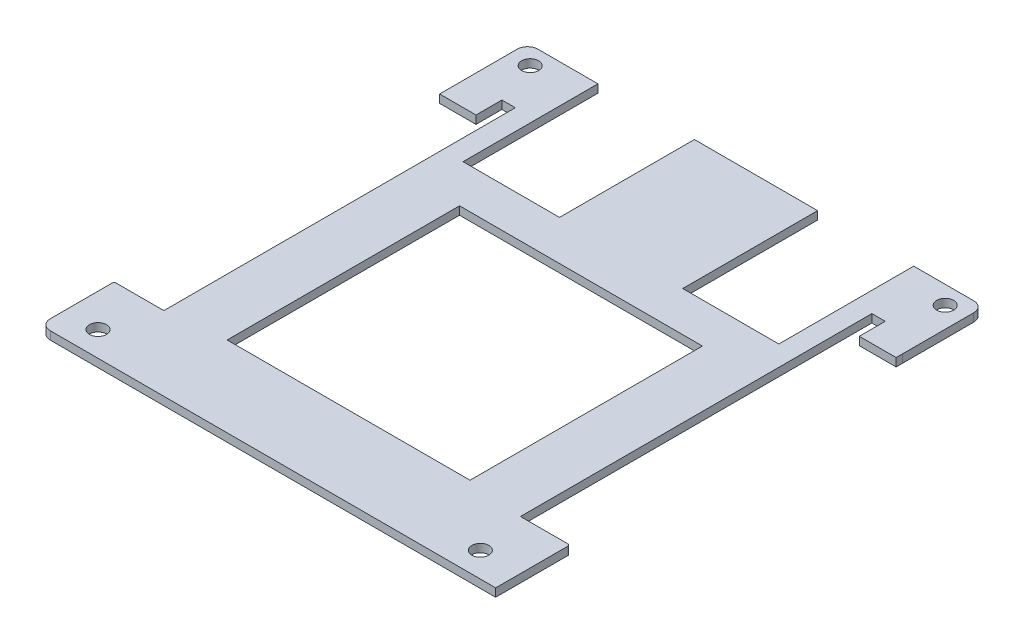
from build123d import *

# Parameters (mm, degrees)
SKETCH1_R                        = 1.6383
BOSS_EXTRUDE1_DEPTH              = 1.575
CUT_EXTRUDE1_DEPTH               = 2.54
CUTOUTS_FOR_THRUSTER_HEADS_DEPTH = 1.575
NOTCH_FOR_BPR_TOP_VIEW_W         = 2.575
NOTCH_FOR_BPR_TOP_VIEW_H         = 6.27
CUT_EXTRUDE11_DEPTH              = 10
NOTCH_FOR_BPL_TOP_VIEW_W         = 2.575
NOTCH_FOR_BPL_TOP_VIEW_H         = 6.27
CUT_EXTRUDE12_DEPTH              = 65.400936523
SKETCH22_W                       = 1.501374709
SKETCH22_H                       = 61.468
SKETCH22_W_2                     = 1.585
BOSS_EXTRUDE2_DEPTH              = 1.575
SKETCH23_W                       = 7.1002401
SKETCH23_H                       = 1.27
SKETCH23_W_2                     = 7.016
CUT_EXTRUDE13_DEPTH              = 65.400936523


with BuildPart() as part:
    # Sketch1 → Boss-Extrude1 (new body)
    with BuildSketch(Plane(origin=(0, 0, 0), x_dir=(1, 0, 0), z_dir=(0, 1, 0))):
        with BuildLine():
            Line((-44, 45), (-44, 29.162404323))
            ThreePointArc((-44, 29.162404323), (-43.886381258, 28.888104416), (-43.612081351, 28.774485674))
            Line((-43.612081351, 28.774485674), (-33.211918649, 28.774485674))
            ThreePointArc((-33.211918649, 28.774485674), (-32.937618742, 28.660866933), (-32.824, 28.386567026))
            Line((-32.824, 28.386567026), (-32.824, -32.305595677))
            ThreePointArc((-32.824, -32.305595677), (-32.937618742, -32.579895584), (-33.211918649, -32.693514326))
            Line((-33.211918649, -32.693514326), (-36.100000052, -32.693514326))
            Line((-36.100000052, -32.693514326), (-43.612081299, -32.693514326))
            ThreePointArc((-43.612081299, -32.693514326), (-43.886381206, -32.807133067), (-43.999999948, -33.081432974))
            Line((-43.999999948, -33.081432974), (-43.999999948, -38.977))
            Line((-43.999999948, -38.977), (-43.999999948, -45))
            ThreePointArc((-43.999999948, -45), (-43.41421351, -46.414213562), (-41.999999948, -47))
            Line((-41.999999948, -47), (42.705916546, -47))
            Line((42.705916546, -47), (43.849731117, -47))
            Line((43.849731117, -47), (43.849731117, -38.27))
            Line((43.849731117, -38.27), (43.849731117, -33.081432974))
            ThreePointArc((43.849731117, -33.081432974), (43.736112376, -32.807133067), (43.461812469, -32.693514326))
            Line((43.461812469, -32.693514326), (36.098785193, -32.693514326))
            Line((36.098785193, -32.693514326), (33.824, -32.693514326))
            Line((33.824, -32.693514326), (32.822785141, -32.693514326))
            Line((32.822785141, -32.693514326), (32.822785141, -30.469351623))
            Line((32.822785141, -30.469351623), (32.822785141, 27.774485674))
            ThreePointArc((32.822785141, 27.774485674), (33.11567836, 28.481592456), (33.822785141, 28.774485674))
            Line((33.822785141, 28.774485674), (43.611054239, 28.774485674))
            ThreePointArc((43.611054239, 28.774485674), (43.885287743, 28.88803803), (43.998972842, 29.162216531))
            Line((43.998972842, 29.162216531), (44, 31.284))
            Line((44, 31.284), (44, 45))
            ThreePointArc((44, 45), (43.414213562, 46.414213562), (42, 47))
            Line((42, 47), (-42, 47))
            ThreePointArc((-42, 47), (-43.414213562, 46.414213562), (-44, 45))
        make_face()
        with Locations(Location((40, 43.5, 0), (0, 0, 270))):
            Circle(SKETCH1_R, mode=Mode.SUBTRACT)
        with Locations(Location((-40, 43.5, 0), (0, 0, 270))):
            Circle(SKETCH1_R, mode=Mode.SUBTRACT)
        with Locations(Location((-37.599999948, -42.2, 0), (0, 0, 270))):
            Circle(SKETCH1_R, mode=Mode.SUBTRACT)
        with Locations(Location((36.100000052, -42.2, 0), (0, 0, 270))):
            Circle(SKETCH1_R, mode=Mode.SUBTRACT)
        Polygon((23.409, -31.5), (-23.409, -31.5), (-23.409, 13.29544), (-12.909, 13.29544), (-12.909, 25.99544), (12.909, 25.99544), (12.909, 13.29544), (23.409, 13.29544), align=None, mode=Mode.SUBTRACT)
    extrude(amount=BOSS_EXTRUDE1_DEPTH)

    # Sketch2 → Cut-Extrude1 (cut)
    with BuildSketch(Plane(origin=(0, 1.575, 0), x_dir=(1, 0, 0), z_dir=(0, 1, 0))):
        Polygon((-12.909, 19.06), (-30.435, 19.06), (-30.435, 47), (30.435, 47), (30.435, 19.06), (12.909, 19.06), (12.909, 25.99544), (-12.909, 25.99544), align=None)
    extrude(amount=-CUT_EXTRUDE1_DEPTH, mode=Mode.SUBTRACT)

    # Sketch16 → Cutouts for Thruster Heads (add)
    with BuildSketch(Plane(origin=(0, 1.575, 0), x_dir=(1, 0, 0), z_dir=(0, 1, 0))):
        Polygon((12.909, 19.06), (12.909, 13.29544), (-12.909, 13.29544), (-12.909, 19.06), (-30.435, 19.06), (-30.435, 21), (-11.838888217, 21), (-11.838888217, 47), (11.909, 47), (11.909, 21), (30.435, 21), (30.435, 19.06), align=None)
    extrude(amount=-CUTOUTS_FOR_THRUSTER_HEADS_DEPTH)

    # Notch for BPR (TOP VIEW) → Cut-Extrude11 (cut)
    with BuildSketch(Plane(origin=(0, 1.575, 0), x_dir=(1, 0, 0), z_dir=(0, 1, 0))):
        with Locations((-35.6965, 31.909485674)):
            Rectangle(NOTCH_FOR_BPR_TOP_VIEW_W, NOTCH_FOR_BPR_TOP_VIEW_H)
    extrude(amount=-CUT_EXTRUDE11_DEPTH, mode=Mode.SUBTRACT)

    # Notch for BPL (TOP VIEW) → Cut-Extrude12 (cut, through all)
    with BuildSketch(Plane(origin=(0, 1.575, 0), x_dir=(1, 0, 0), z_dir=(0, 1, 0))):
        with Locations((35.61165985, 31.909485674)):
            Rectangle(NOTCH_FOR_BPL_TOP_VIEW_W, NOTCH_FOR_BPL_TOP_VIEW_H)
    extrude(amount=-CUT_EXTRUDE12_DEPTH, mode=Mode.SUBTRACT)

    # Sketch22 → Boss-Extrude2 (add)
    with BuildSketch(Plane(origin=(0, 1.575, 0), x_dir=(1, 0, 0), z_dir=(0, 1, 0))):
        with Locations((33.573472495, -1.959514326)):
            Rectangle(SKETCH22_W, SKETCH22_H)
        with Locations((-33.6165, -1.959514326)):
            Rectangle(SKETCH22_W_2, SKETCH22_H)
    extrude(amount=-BOSS_EXTRUDE2_DEPTH)

    # Sketch23 → Cut-Extrude13 (cut, through all)
    with BuildSketch(Plane(origin=(0, 1.575, 0), x_dir=(1, 0, 0), z_dir=(0, 1, 0))):
        with Locations((40.4492799, 29.409485674)):
            Rectangle(SKETCH23_W, SKETCH23_H)
        with Locations((-40.492, 29.409485674)):
            Rectangle(SKETCH23_W_2, SKETCH23_H)
    extrude(amount=-CUT_EXTRUDE13_DEPTH, mode=Mode.SUBTRACT)


solid = part.part
